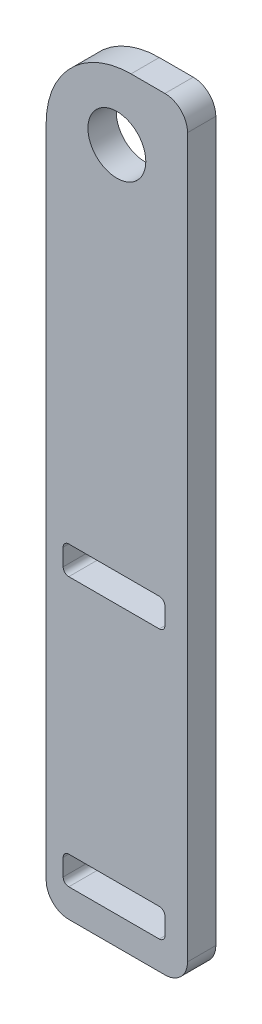
from build123d import *

# Parameters (mm, degrees)
SKETCH1_R           = 3.25
BOSS_EXTRUDE1_DEPTH = 3.175


with BuildPart() as part:
    # Sketch1 → Boss-Extrude1 (new body)
    with BuildSketch(Plane.XY):
        with BuildLine():
            Line((-7.9375, -1.830947062), (-7.9375, -75.490947062))
            ThreePointArc((-7.9375, -75.490947062), (-7.193551224, -77.286998286), (-5.3975, -78.030947062))
            Line((-5.3975, -78.030947062), (5.3975, -78.030947062))
            ThreePointArc((5.3975, -78.030947062), (7.193551224, -77.286998286), (7.9375, -75.490947062))
            Line((7.9375, -75.490947062), (7.9375, 5.154052938))
            ThreePointArc((7.9375, 5.154052938), (7.193551224, 6.950104162), (5.3975, 7.694052938))
            Line((5.3975, 7.694052938), (1.5875, 7.694052938))
            ThreePointArc((1.5875, 7.694052938), (-5.147692091, 4.904245029), (-7.9375, -1.830947062))
        make_face()
        Circle(SKETCH1_R, mode=Mode.SUBTRACT)
        with BuildLine():
            Line((-5.3975, -71.680947062), (4.7625, -71.680947062))
            ThreePointArc((4.7625, -71.680947062), (5.211512806, -71.866934256), (5.3975, -72.315947062))
            Line((5.3975, -72.315947062), (5.3975, -74.220947062))
            ThreePointArc((5.3975, -74.220947062), (5.211512806, -74.669959868), (4.7625, -74.855947062))
            Line((4.7625, -74.855947062), (-5.3975, -74.855947062))
            ThreePointArc((-5.3975, -74.855947062), (-5.846512806, -74.669959868), (-6.0325, -74.220947062))
            Line((-6.0325, -74.220947062), (-6.0325, -72.315947062))
            ThreePointArc((-6.0325, -72.315947062), (-5.846512806, -71.866934256), (-5.3975, -71.680947062))
        make_face(mode=Mode.SUBTRACT)
        with BuildLine():
            Line((-5.3975, -41.518447062), (4.7625, -41.518447062))
            ThreePointArc((4.7625, -41.518447062), (5.211512806, -41.704434256), (5.3975, -42.153447062))
            Line((5.3975, -42.153447062), (5.3975, -44.058447062))
            ThreePointArc((5.3975, -44.058447062), (5.211512806, -44.507459868), (4.7625, -44.693447062))
            Line((4.7625, -44.693447062), (-5.3975, -44.693447062))
            ThreePointArc((-5.3975, -44.693447062), (-5.846512806, -44.507459868), (-6.0325, -44.058447062))
            Line((-6.0325, -44.058447062), (-6.0325, -42.153447062))
            ThreePointArc((-6.0325, -42.153447062), (-5.846512806, -41.704434256), (-5.3975, -41.518447062))
        make_face(mode=Mode.SUBTRACT)
    extrude(amount=BOSS_EXTRUDE1_DEPTH)


solid = part.part
